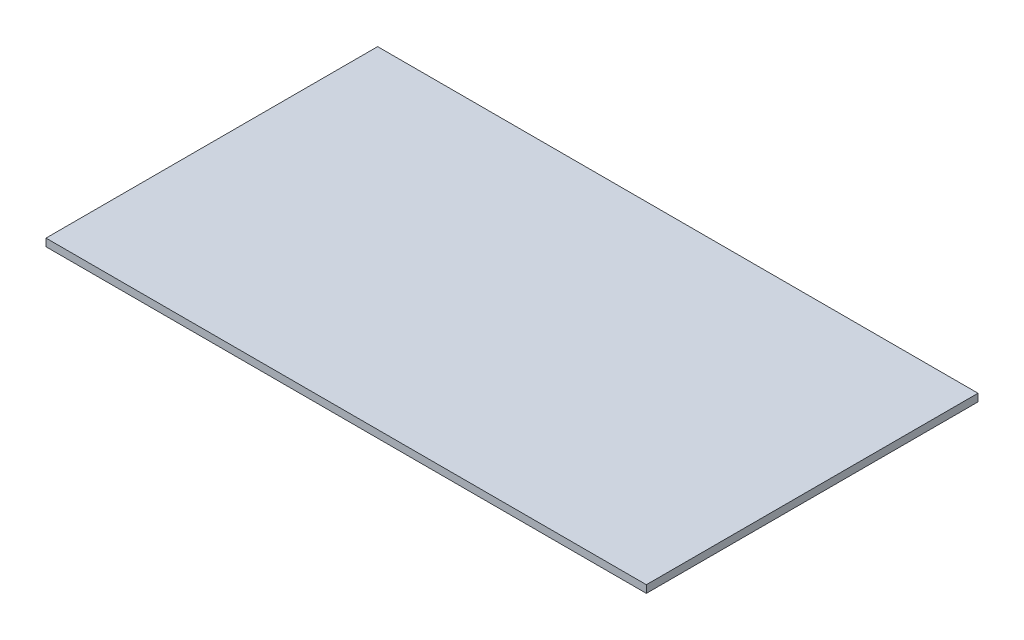
from build123d import *

# Parameters (mm, degrees)
SKETCH1_W           = 252.9
SKETCH1_H           = 139.7
BOSS_EXTRUDE1_DEPTH = 3.175


with BuildPart() as part:
    # Sketch1 → Boss-Extrude1 (new body)
    with BuildSketch(Plane(origin=(0, 0, 0), x_dir=(1, 0, 0), z_dir=(0, 1, 0))):
        with Locations((126.45, 69.85)):
            Rectangle(SKETCH1_W, SKETCH1_H)
    extrude(amount=BOSS_EXTRUDE1_DEPTH)


solid = part.part
